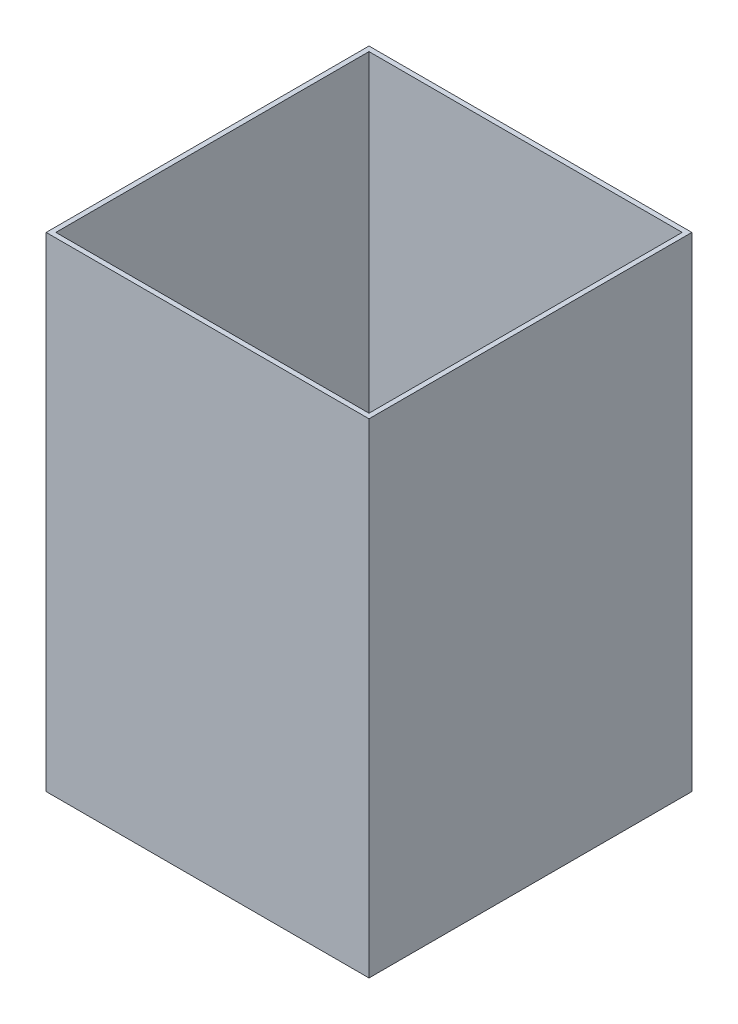
from build123d import *

# Parameters (mm, degrees)
SKETCH1_W           = 100
SKETCH1_H           = 100
SKETCH1_W_2         = 97
SKETCH1_H_2         = 97
BOSS_EXTRUDE1_DEPTH = 150


with BuildPart() as part:
    # Sketch1 → Boss-Extrude1 (new body)
    with BuildSketch(Plane(origin=(0, 0, 0), x_dir=(1, 0, 0), z_dir=(0, 1, 0))):
        Rectangle(SKETCH1_W, SKETCH1_H)
        Rectangle(SKETCH1_W_2, SKETCH1_H_2, mode=Mode.SUBTRACT)
    extrude(amount=BOSS_EXTRUDE1_DEPTH)


solid = part.part
